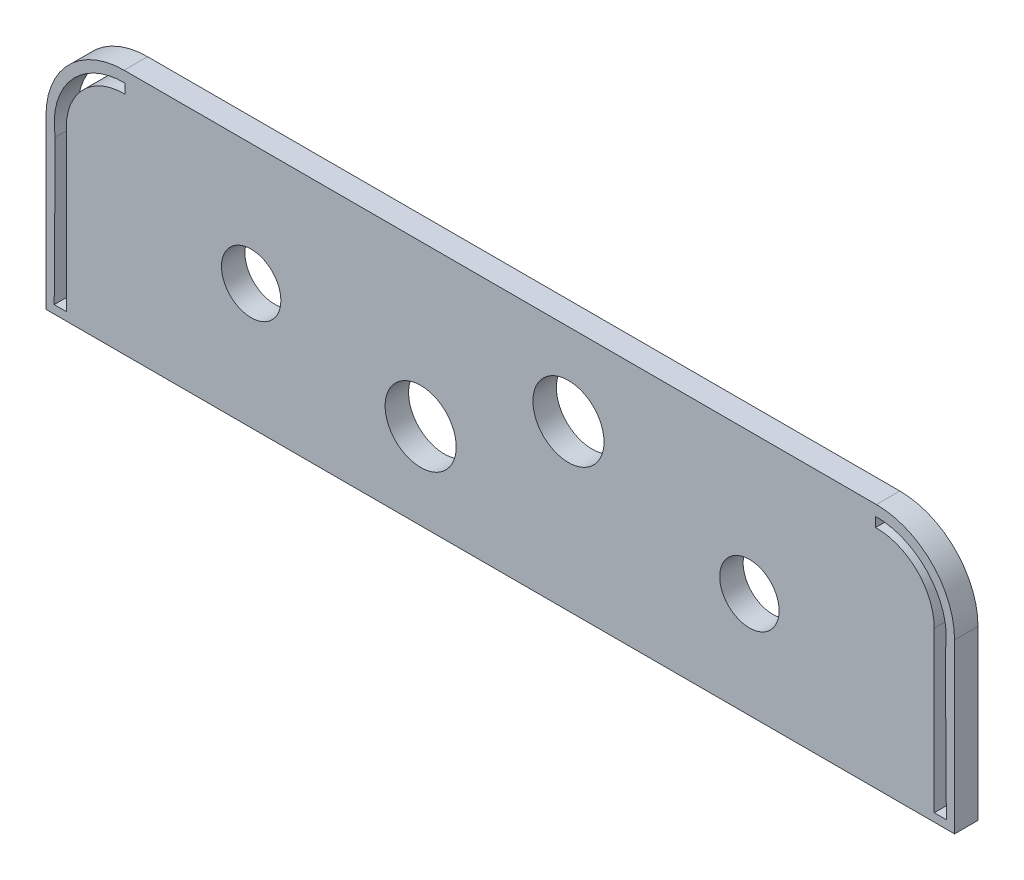
from build123d import *

# Parameters (mm, degrees)
SKETCH1_R           = 3.8
BOSS_EXTRUDE2_DEPTH = 3
SKETCH2_R           = 4.4
BOSS_EXTRUDE3_DEPTH = 25
CUT_EXTRUDE3_START  = -1
SKETCH10_R          = 4.4
CUT_EXTRUDE3_DEPTH  = 1
CUT_EXTRUDE4_DEPTH  = 50
SKETCH12_R          = 4.55
CUT_EXTRUDE6_DEPTH  = 50
CUT_EXTRUDE7_DEPTH  = 25


with BuildPart() as part:
    # Sketch1 → Boss-Extrude2 (new body)
    with BuildSketch(Plane.XY):
        with BuildLine():
            Line((-48.125, 15.75), (48.125, 15.75))
            ThreePointArc((48.125, 15.75), (55.196067812, 12.821067812), (58.125, 5.75))
            Line((58.125, 5.75), (58.125, -15.75))
            Line((58.125, -15.75), (-58.125, -15.75))
            Line((-58.125, -15.75), (-58.125, 5.75))
            ThreePointArc((-58.125, 5.75), (-55.196067812, 12.821067812), (-48.125, 15.75))
        make_face()
        with Locations((31.875, -2.25)):
            Circle(SKETCH1_R, mode=Mode.SUBTRACT)
        with Locations((-31.875, 0.25)):
            Circle(SKETCH1_R, mode=Mode.SUBTRACT)
    extrude(amount=BOSS_EXTRUDE2_DEPTH)

    # Sketch2 → Boss-Extrude3 (add)
    with BuildSketch(Plane.XY.offset(3)):
        with Locations((8.725, 5.25)):
            Circle(SKETCH2_R)
        with Locations((-10.185, -4.75)):
            Circle(SKETCH2_R)
        with BuildLine():
            Line((55.625, 5.75), (55.625, -15.75))
            Line((55.625, -15.75), (58.125, -15.75))
            Line((58.125, -15.75), (58.125, 5.25))
            Line((58.125, 5.25), (58.125, 5.75))
            ThreePointArc((58.125, 5.75), (55.196067812, 12.821067812), (48.125, 15.75))
            Line((48.125, 15.75), (48.125, 13.25))
            ThreePointArc((48.125, 13.25), (53.428300859, 11.053300859), (55.625, 5.75))
        make_face()
        with BuildLine():
            Line((-58.125, -15.75), (-55.625, -15.75))
            Line((-55.625, -15.75), (-55.625, 5.75))
            ThreePointArc((-55.625, 5.75), (-53.428300859, 11.053300859), (-48.125, 13.25))
            Line((-48.125, 13.25), (-48.125, 15.75))
            ThreePointArc((-48.125, 15.75), (-55.196067812, 12.821067812), (-58.125, 5.75))
            Line((-58.125, 5.75), (-58.125, 5.25))
            Line((-58.125, 5.25), (-58.125, -15.75))
        make_face()
    extrude(amount=BOSS_EXTRUDE3_DEPTH)

    # Sketch10 → Cut-Extrude3 (cut)
    with BuildSketch(Plane.XY.offset(28).offset(CUT_EXTRUDE3_START)):
        with Locations((8.725, 5.25)):
            Circle(SKETCH10_R)
        with Locations((-10.185, -4.75)):
            Circle(SKETCH10_R)
    extrude(amount=CUT_EXTRUDE3_DEPTH, mode=Mode.SUBTRACT)

    # Sketch5 → Cut-Extrude4 (cut)
    with BuildSketch(Plane.XY.offset(28)):
        with BuildLine():
            Line((55.525, -14.7), (55.525, 5.75))
            ThreePointArc((55.525, 5.75), (53.322114584, 11.017826876), (48.025, 13.149324293))
            Line((48.025, 13.149324293), (48.025, 14.384631142))
            ThreePointArc((48.025, 14.384631142), (54.933874825, 11.243952477), (56.946937757, 3.926576481))
            Line((56.946937757, 3.926576481), (57.075693637, -14.7))
            Line((57.075693637, -14.7), (55.525, -14.7))
        make_face()
        with BuildLine():
            Line((-56.946937757, 3.926576481), (-57.075693637, -14.7))
            Line((-57.075693637, -14.7), (-55.525, -14.7))
            Line((-55.525, -14.7), (-55.525, 5.75))
            ThreePointArc((-55.525, 5.75), (-53.322114584, 11.017826876), (-48.025, 13.149324293))
            Line((-48.025, 13.149324293), (-48.025, 14.384631142))
            ThreePointArc((-48.025, 14.384631142), (-54.933874825, 11.243952477), (-56.946937757, 3.926576481))
        make_face()
    extrude(amount=-CUT_EXTRUDE4_DEPTH, mode=Mode.SUBTRACT)

    # Sketch12 → Cut-Extrude6 (cut)
    with BuildSketch(Plane.XY.offset(27)):
        with Locations((-10.185, -4.75)):
            Circle(SKETCH12_R)
        with Locations((8.725, 5.25)):
            Circle(SKETCH12_R)
    extrude(amount=-CUT_EXTRUDE6_DEPTH, mode=Mode.SUBTRACT)

    # Sketch13 → Cut-Extrude7 (cut)
    with BuildSketch(Plane.XY.offset(28)):
        with BuildLine():
            Line((57.075693637, -14.7), (55.625, -14.7))
            Line((55.625, -14.7), (55.625, -15.75))
            Line((55.625, -15.75), (58.125, -15.75))
            Line((58.125, -15.75), (58.125, 5.75))
            ThreePointArc((58.125, 5.75), (55.196067812, 12.821067812), (48.125, 15.75))
            Line((48.125, 15.75), (48.125, 14.385189819))
            ThreePointArc((48.125, 14.385189819), (54.966220263, 11.205822827), (56.946937757, 3.926576481))
            Line((56.946937757, 3.926576481), (57.075693637, -14.7))
        make_face()
        with BuildLine():
            Line((-48.125, 14.385189819), (-48.125, 15.75))
            ThreePointArc((-48.125, 15.75), (-55.196067812, 12.821067812), (-58.125, 5.75))
            Line((-58.125, 5.75), (-58.125, -15.75))
            Line((-58.125, -15.75), (-55.625, -15.75))
            Line((-55.625, -15.75), (-55.625, -14.7))
            Line((-55.625, -14.7), (-57.075693637, -14.7))
            Line((-57.075693637, -14.7), (-56.946937757, 3.926576481))
            ThreePointArc((-56.946937757, 3.926576481), (-54.966220263, 11.205822827), (-48.125, 14.385189819))
        make_face()
    extrude(amount=-CUT_EXTRUDE7_DEPTH, mode=Mode.SUBTRACT)


solid = part.part
